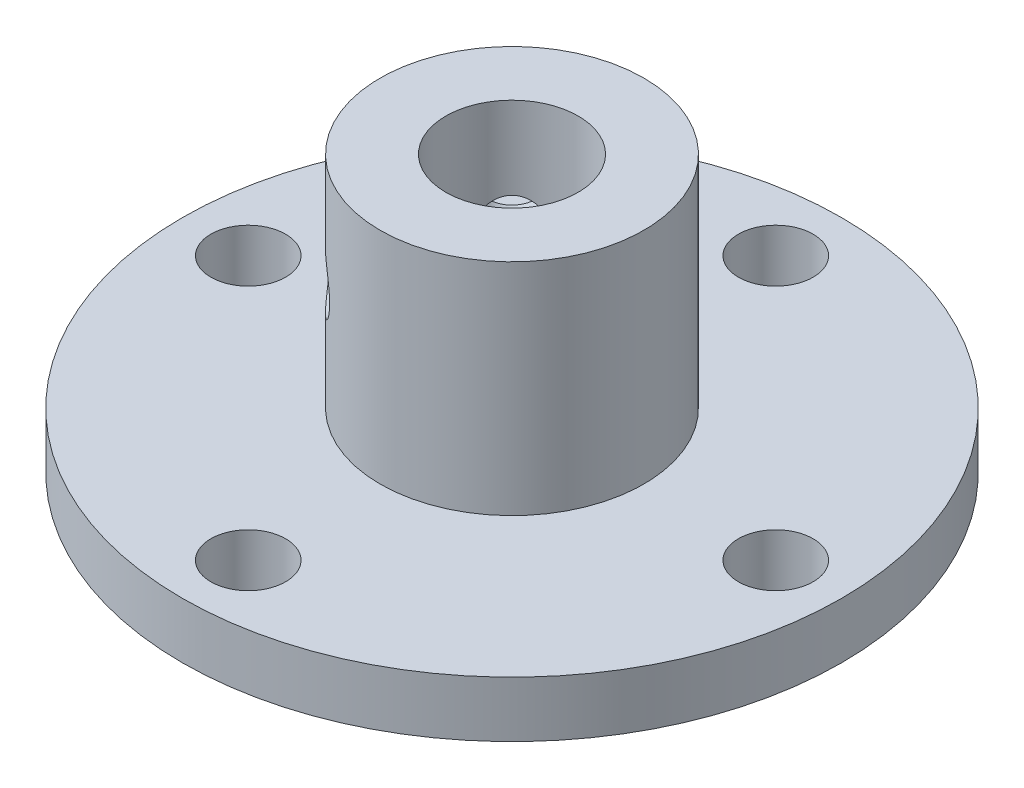
from build123d import *

# Parameters (mm, degrees)
SKETCH1_R                        = 15
SKETCH1_R_2                      = 6
SKETCH1_R_3                      = 3.01
BOSS_EXTRUDE4_DEPTH              = 2.54
BOSS_EXTRUDE5_START              = 10
SKETCH1_8_R                      = 6
SKETCH1_8_R_2                    = 3.01
BOSS_EXTRUDE5_DEPTH              = 10
M3_CLEARANCE_HOLE1_D             = 3.4
TAP_DRILL_FOR_M3X0_5_TAP1_REACH  = 30.992
TAP_DRILL_FOR_M3X0_5_TAP1_BORE_R = 1.25
TAP_DRILL_FOR_M3X0_5_TAP2_REACH  = 30.992
TAP_DRILL_FOR_M3X0_5_TAP2_BORE_R = 1.25


with BuildPart() as part:
    # Sketch1 → Boss-Extrude4 (new body)
    # profile 1 of 2: a face of its own
    with BuildSketch(Plane(origin=(0, 0, 0), x_dir=(1, 0, 0), z_dir=(0, 1, 0))):
        with Locations(Location((0, 0, 0), (0, 0, 270))):
            Circle(SKETCH1_R)
        Circle(SKETCH1_R_2, mode=Mode.SUBTRACT)
    # profile 2 of 2: a face of its own
    with BuildSketch(Plane(origin=(0, 0, 0), x_dir=(1, 0, 0), z_dir=(0, 1, 0))):
        Circle(SKETCH1_R_2)
        with Locations(Location((0, 0, 0), (0, 0, 270))):
            Circle(SKETCH1_R_3, mode=Mode.SUBTRACT)
    extrude(amount=-BOSS_EXTRUDE4_DEPTH)

    # Sketch1<8> → Boss-Extrude5 (add)
    with BuildSketch(Plane(origin=(0, 0, 0), x_dir=(1, 0, 0), z_dir=(0, 1, 0)).offset(BOSS_EXTRUDE5_START)):
        with Locations(Location((0, 0, 0), (0, 0, 270))):
            Circle(SKETCH1_8_R)
        with Locations(Location((0, 0, 0), (0, 0, 270))):
            Circle(SKETCH1_8_R_2, mode=Mode.SUBTRACT)
    extrude(amount=-BOSS_EXTRUDE5_DEPTH)

    # M3 Clearance Hole1 (through all)
    with Locations(Plane(origin=(0, 0, 0), x_dir=(1, 0, 0), z_dir=(0, 1, 0))):
        with Locations((0, 12), (12, 0), (-12, 0), (0, -12)):
            Hole(M3_CLEARANCE_HOLE1_D / 2)

    # Tap Drill for M3x0.5 Tap1 bore → Tap Drill for M3x0.5 Tap1 (cut, up to next)
    with BuildSketch(Plane(origin=(-4.242640687, 0, -4.242640687), x_dir=(0, -1, 0), z_dir=(-0.7071067811865464, 0, -0.7071067811865488)), mode=Mode.PRIVATE) as tap_drill_for_m3x0_5_tap1_sk1:
        with Locations((-5, 0)):
            Circle(TAP_DRILL_FOR_M3X0_5_TAP1_BORE_R)
    tap_drill_for_m3x0_5_tap1_tool1 = extrude(tap_drill_for_m3x0_5_tap1_sk1.sketch, amount=-TAP_DRILL_FOR_M3X0_5_TAP1_REACH, mode=Mode.PRIVATE) & part.part
    add(tap_drill_for_m3x0_5_tap1_tool1.solids().sort_by_distance((-4.242641, 5, -4.242641))[0], mode=Mode.SUBTRACT)

    # Tap Drill for M3x0.5 Tap2 bore → Tap Drill for M3x0.5 Tap2 (cut, up to next)
    with BuildSketch(Plane(origin=(-4.242640687, 0, 4.242640687), x_dir=(0, -1, 0), z_dir=(-0.7071067811865512, 0, 0.7071067811865438)), mode=Mode.PRIVATE) as tap_drill_for_m3x0_5_tap2_sk1:
        with Locations((-5, 0)):
            Circle(TAP_DRILL_FOR_M3X0_5_TAP2_BORE_R)
    tap_drill_for_m3x0_5_tap2_tool1 = extrude(tap_drill_for_m3x0_5_tap2_sk1.sketch, amount=-TAP_DRILL_FOR_M3X0_5_TAP2_REACH, mode=Mode.PRIVATE) & part.part
    add(tap_drill_for_m3x0_5_tap2_tool1.solids().sort_by_distance((-4.242641, 5, 4.242641))[0], mode=Mode.SUBTRACT)


solid = part.part
